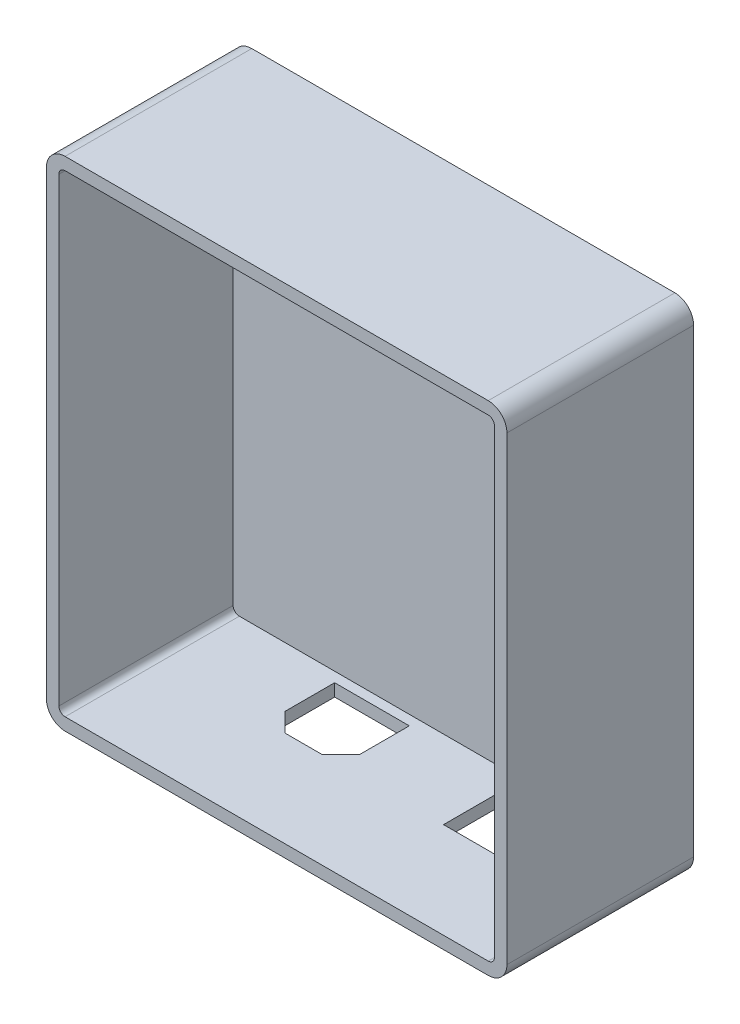
from build123d import *

# Parameters (mm, degrees)
BOSS_EXTRUDE2_DEPTH = 30
CUT_EXTRUDE3_DEPTH  = 28
SKETCH10_W          = 9
SKETCH10_H          = 11
CUT_EXTRUDE4_DEPTH  = 3


with BuildPart() as part:
    # Sketch2 → Boss-Extrude2 (new body)
    with BuildSketch(Plane.XY):
        with BuildLine():
            Line((-28.917214192, 20.79500657), (39.082785808, 20.79500657))
            ThreePointArc((39.082785808, 20.79500657), (41.204106152, 19.916326914), (42.082785808, 17.79500657))
            Line((42.082785808, 17.79500657), (42.082785808, -56.20499343))
            ThreePointArc((42.082785808, -56.20499343), (41.204106152, -58.326313773), (39.082785808, -59.20499343))
            Line((39.082785808, -59.20499343), (-28.917214192, -59.20499343))
            ThreePointArc((-28.917214192, -59.20499343), (-31.038534535, -58.326313773), (-31.917214192, -56.20499343))
            Line((-31.917214192, -56.20499343), (-31.917214192, 17.79500657))
            ThreePointArc((-31.917214192, 17.79500657), (-31.038534535, 19.916326914), (-28.917214192, 20.79500657))
        make_face()
    extrude(amount=BOSS_EXTRUDE2_DEPTH)

    # Sketch7 → Cut-Extrude3 (cut)
    with BuildSketch(Plane.XY.offset(30)):
        with BuildLine():
            Line((-28.917214192, -57.20499343), (39.082785808, -57.20499343))
            ThreePointArc((39.082785808, -57.20499343), (39.789892589, -56.912100211), (40.082785808, -56.20499343))
            Line((40.082785808, -56.20499343), (40.082785808, 17.79500657))
            ThreePointArc((40.082785808, 17.79500657), (39.789892589, 18.502113351), (39.082785808, 18.79500657))
            Line((39.082785808, 18.79500657), (-28.917214192, 18.79500657))
            ThreePointArc((-28.917214192, 18.79500657), (-29.624320973, 18.502113351), (-29.917214192, 17.79500657))
            Line((-29.917214192, 17.79500657), (-29.917214192, -56.20499343))
            ThreePointArc((-29.917214192, -56.20499343), (-29.624320973, -56.912100211), (-28.917214192, -57.20499343))
        make_face()
    extrude(amount=-CUT_EXTRUDE3_DEPTH, mode=Mode.SUBTRACT)

    # Sketch10 → Cut-Extrude4 (cut)
    with BuildSketch(Plane.XZ.offset(59.20499343)):
        Polygon((-12, 11.6), (-9.001867248, 14.598132752), (-3.001867248, 14.598132752), (0, 11.603739153), (0, 3.6), (-12, 3.6), align=None)
        with Locations((21, 9.1)):
            Rectangle(SKETCH10_W, SKETCH10_H)
    extrude(amount=-CUT_EXTRUDE4_DEPTH, mode=Mode.SUBTRACT)


solid = part.part
